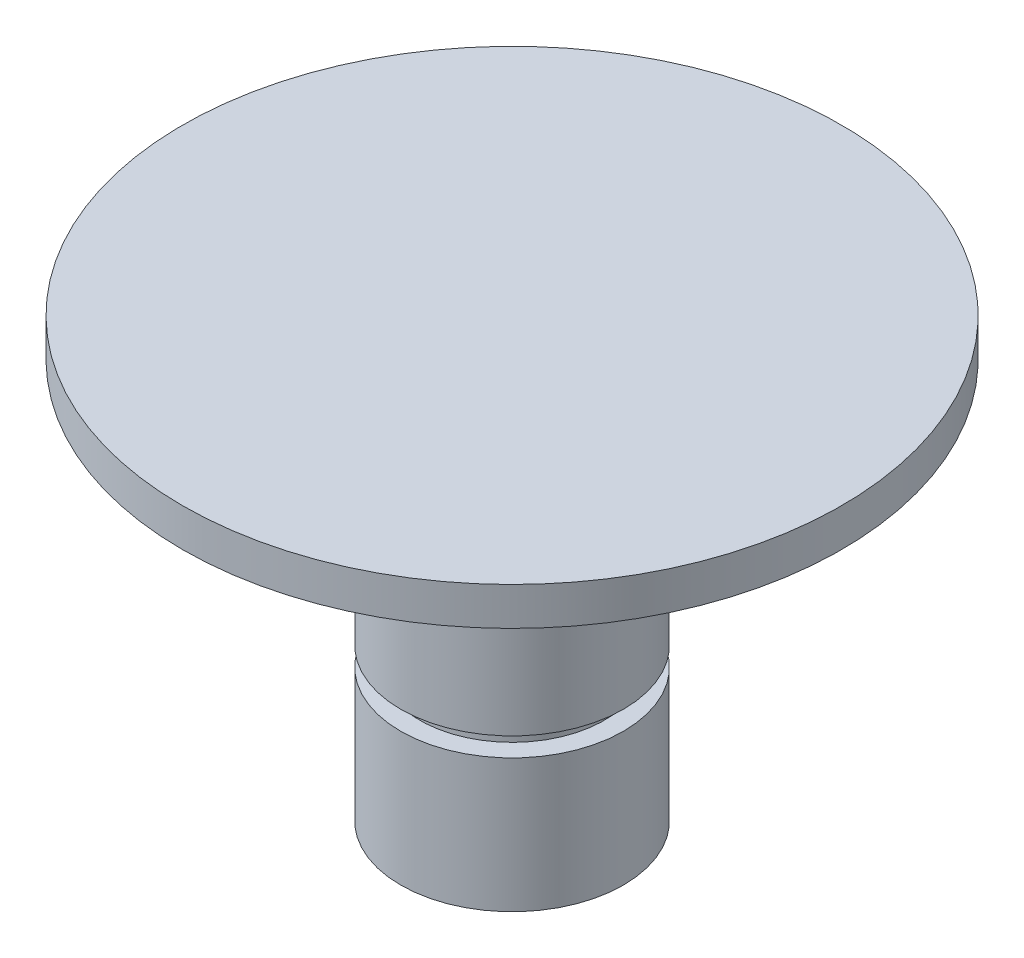
from build123d import *

# Parameters (mm, degrees)
SKETCH1_R           = 5.85
BOSS_EXTRUDE1_DEPTH = 21
SKETCH2_R           = 17.316392141
BOSS_EXTRUDE2_DEPTH = 2
CUT_EXTRUDE1_START  = 1
SKETCH3_R           = 5.85
SKETCH3_R_2         = 4.85
CUT_EXTRUDE1_DEPTH  = 1
SKETCH4_R           = 1.5
CUT_EXTRUDE2_DEPTH  = 5
BOSS_EXTRUDE4_START = 3
SKETCH5_R           = 8.85
SKETCH5_R_2         = 5.85
BOSS_EXTRUDE4_DEPTH = 3


with BuildPart() as part:
    # Sketch1 → Boss-Extrude1 (new body)
    with BuildSketch(Plane(origin=(0, 0, 0), x_dir=(1, 0, 0), z_dir=(0, 1, 0))):
        with Locations(Location((0, 0, 0), (0, 0, 90))):
            Circle(SKETCH1_R)
    extrude(amount=BOSS_EXTRUDE1_DEPTH)

    # Sketch2 → Boss-Extrude2 (add)
    with BuildSketch(Plane(origin=(0, 21, 0), x_dir=(1, 0, 0), z_dir=(0, 1, 0))):
        with Locations(Location((0, 0, 0), (0, 0, 270))):
            Circle(SKETCH2_R)
    extrude(amount=BOSS_EXTRUDE2_DEPTH)

    # Sketch3 → Cut-Extrude1 (cut)
    with BuildSketch(Plane(origin=(0, 8, 0), x_dir=(-1, 0, 0), z_dir=(0, -1, 0)).offset(CUT_EXTRUDE1_START)):
        with Locations(Location((0, 0, 0), (0, 0, 90))):
            Circle(SKETCH3_R)
        with Locations(Location((0, 0, 0), (0, 0, 90))):
            Circle(SKETCH3_R_2, mode=Mode.SUBTRACT)
    extrude(amount=-CUT_EXTRUDE1_DEPTH, mode=Mode.SUBTRACT)

    # Sketch4 → Cut-Extrude2 (cut)
    with BuildSketch(Plane.XZ):
        with Locations(Location((0, 0, 0), (0, 0, 270))):
            Circle(SKETCH4_R)
    extrude(amount=-CUT_EXTRUDE2_DEPTH, mode=Mode.SUBTRACT)

    # Sketch5 → Boss-Extrude4 (add)
    with BuildSketch(Plane.XZ.offset(-21).offset(BOSS_EXTRUDE4_START)):
        with Locations(Location((0, 0, 0), (0, 0, 90))):
            Circle(SKETCH5_R)
        with Locations(Location((0, 0, 0), (0, 0, 270))):
            Circle(SKETCH5_R_2, mode=Mode.SUBTRACT)
    extrude(amount=-BOSS_EXTRUDE4_DEPTH)


solid = part.part
